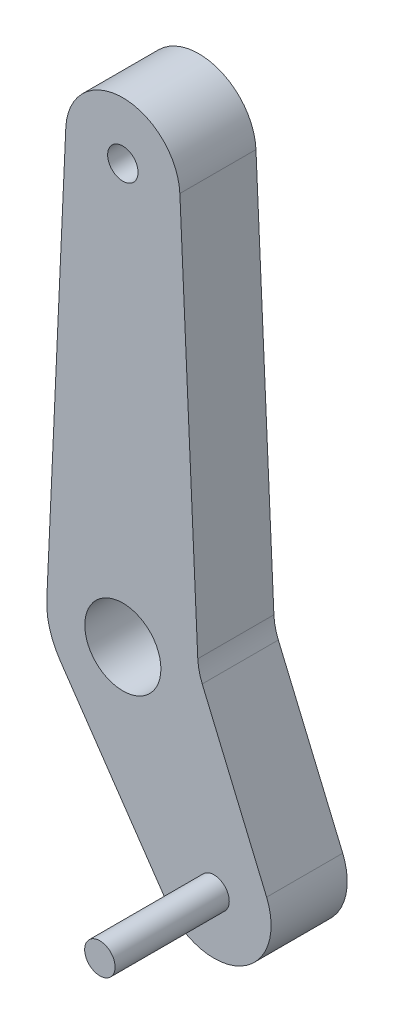
from build123d import *

# Parameters (mm, degrees)
SKETCH_1_R      = 10
SKETCH_1_R_2    = 4
EXTRUDE_1_DEPTH = 20
SKETCH_2_R      = 4
EXTRUDE_2_DEPTH = 30


with BuildPart() as part:
    # 草图1 → 凸台-拉伸1 (new body)
    with BuildSketch(Plane.XY):
        with BuildLine():
            Line((-14.98449612, 110.681818182), (-19.97932816, 0.909090909))
            ThreePointArc((-19.97932816, 0.909090909), (-19.236072743, -5.474806428), (-16.506376679, -11.293340025))
            Line((-16.506376679, -11.293340025), (11.58545194, -52.352433595))
            ThreePointArc((11.58545194, -52.352433595), (31.154804784, -57.04715715), (37.782931026, -38.045369273))
            Line((37.782931026, -38.045369273), (20.861374384, 2.011947794))
            ThreePointArc((20.861374384, 2.011947794), (20.049111843, 4.537769231), (19.694574841, 7.167188916))
            Line((19.694574841, 7.167188916), (14.98449612, 110.681818182))
            ThreePointArc((14.98449612, 110.681818182), (0, 125), (-14.98449612, 110.681818182))
        make_face()
        Circle(SKETCH_1_R, mode=Mode.SUBTRACT)
        with Locations((0, 110)):
            Circle(SKETCH_1_R_2, mode=Mode.SUBTRACT)
    extrude(amount=EXTRUDE_1_DEPTH)

    # 草图2 → 凸台-拉伸2 (add)
    with BuildSketch(Plane.XY.offset(20)):
        with Locations((23.965234449, -43.882428577)):
            Circle(SKETCH_2_R)
    extrude(amount=EXTRUDE_2_DEPTH)


solid = part.part
